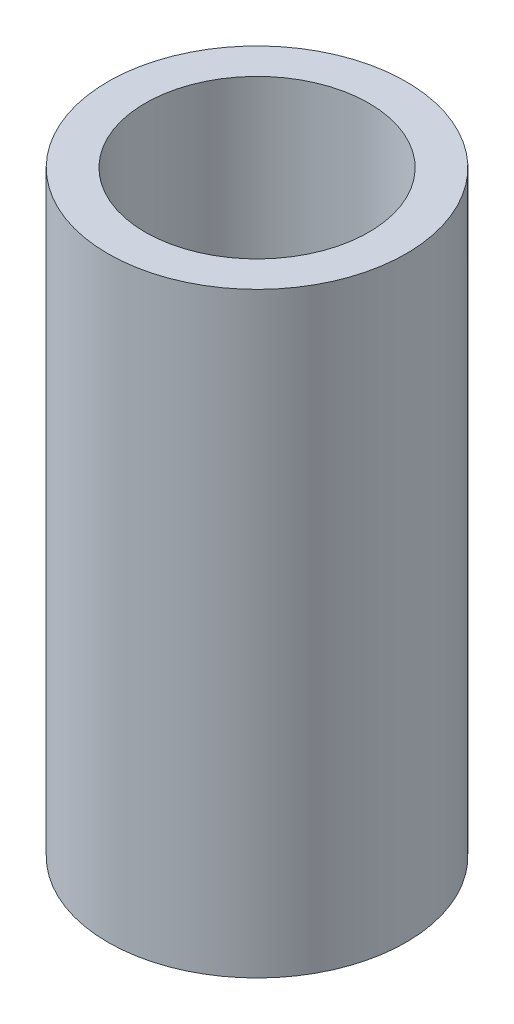
from build123d import *

# Parameters (mm, degrees)
SKETCH1_R             = 12.7
EXTRUDE1_DEPTH        = 50.8
SHELL1_T              = -3.175
F_4_40_TAPPED_HOLE1_D = 2.2606
F_4_40_TAPPED_HOLE2_D = 2.2606
SKETCH8_R             = 3.571875
CUT_EXTRUDE1_DEPTH    = 54.881536726


with BuildPart() as part:
    # Sketch1 → Extrude1 (new body)
    with BuildSketch(Plane(origin=(0, 0, 0), x_dir=(1, 0, 0), z_dir=(0, 1, 0))):
        with Locations(Location((0, 0, 0), (0, 0, 270))):
            Circle(SKETCH1_R)
    extrude(amount=EXTRUDE1_DEPTH)

    # Shell1
    shell1_openings = [part.faces().sort_by_distance(p)[0] for p in [
        (0, 50.8, 0),
    ]]
    offset(amount=SHELL1_T, openings=shell1_openings, kind=Kind.INTERSECTION)

    # #4-40 Tapped Hole1 (through all)
    with Locations(Plane(origin=(0, 0, 7.14375), x_dir=(0, 0, -1), z_dir=(0, -1, 0))):
        with Locations((0, 0)):
            Hole(F_4_40_TAPPED_HOLE1_D / 2)

    # #4-40 Tapped Hole2 (through all)
    with Locations(Plane(origin=(0, 0, -7.14375), x_dir=(0, 0, -1), z_dir=(0, -1, 0))):
        with Locations((0, 0)):
            Hole(F_4_40_TAPPED_HOLE2_D / 2)

    # Sketch8 → Cut-Extrude1 (cut, through all)
    with BuildSketch(Plane.XZ):
        with Locations(Location((0, 0, 0), (0, 0, 270))):
            Circle(SKETCH8_R)
    extrude(amount=-CUT_EXTRUDE1_DEPTH, mode=Mode.SUBTRACT)


solid = part.part
